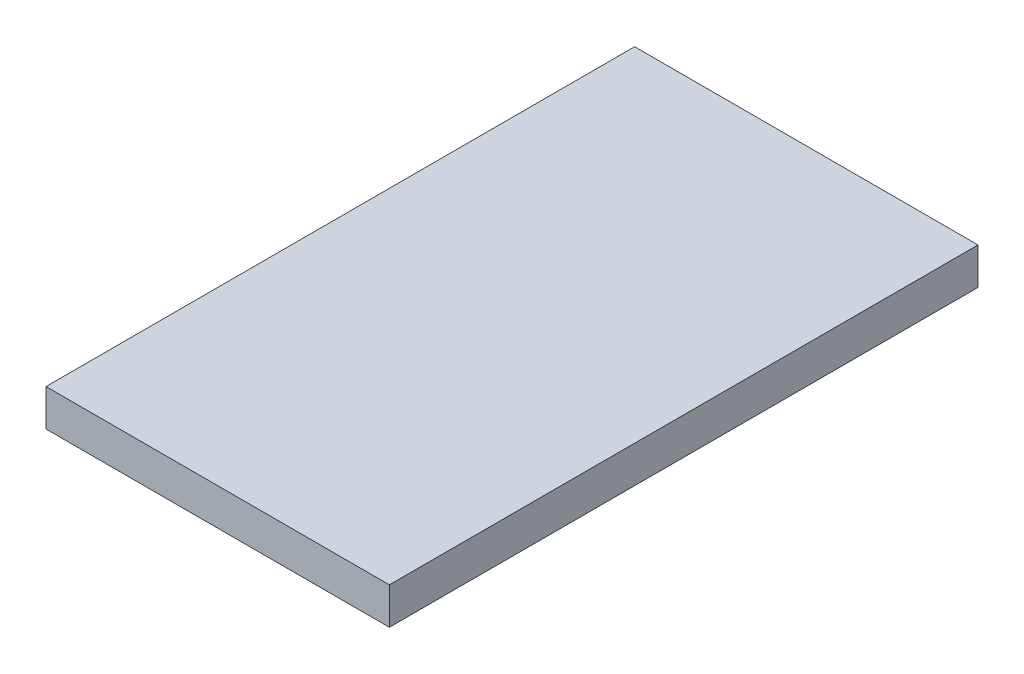
from build123d import *

# Parameters (mm, degrees)
SKETCH1_W           = 177.8
SKETCH1_H           = 304.8
BOSS_EXTRUDE1_DEPTH = 9.525


with BuildPart() as part:
    # Sketch1 → Boss-Extrude1 (new, symmetric)
    with BuildSketch(Plane(origin=(0, 0, 0), x_dir=(1, 0, 0), z_dir=(0, 1, 0))):
        Rectangle(SKETCH1_W, SKETCH1_H)
    extrude(amount=BOSS_EXTRUDE1_DEPTH, both=True)


solid = part.part
